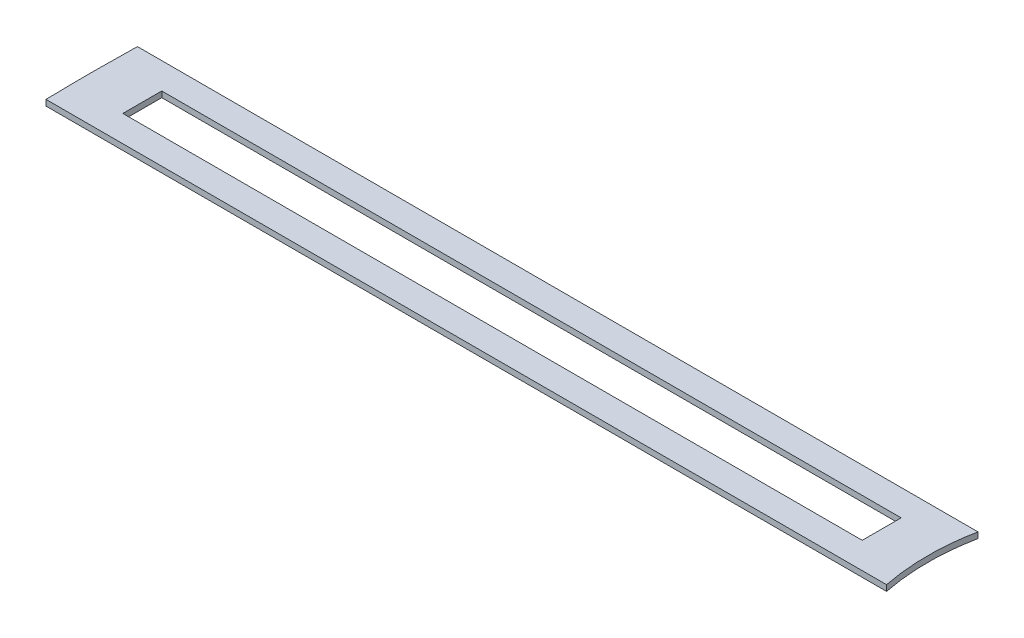
from build123d import *

# Parameters (mm, degrees)
SKETCH1_W           = 380
SKETCH1_H           = 20
BOSS_EXTRUDE1_DEPTH = 1.5


with BuildPart() as part:
    # Sketch1 → Boss-Extrude1 (new, symmetric)
    with BuildSketch(Plane(origin=(0, 0, 0), x_dir=(1, 0, 0), z_dir=(0, 1, 0))):
        with BuildLine():
            Line((216, -23.5), (-216, -23.5))
            add(Edge.make_bspline(
                [(-216, 23.5), (-216.558662782, 0), (-216, -23.5)],
                knots=[4.678781703, 4.678781703, 4.678781703, 4.745996258, 4.745996258, 4.745996258], degree=2, weights=[1, 0.999435329, 1]))
            Line((-216, 23.5), (216, 23.5))
            add(Edge.make_bspline(
                [(216, 23.5), (211.258139768, 0), (216, -23.5)],
                knots=[4.434415205, 4.434415205, 4.434415205, 4.990362756, 4.990362756, 4.990362756], degree=2, weights=[1, 0.961613424, 1]))
        make_face()
        Rectangle(SKETCH1_W, SKETCH1_H, mode=Mode.SUBTRACT)
    extrude(amount=BOSS_EXTRUDE1_DEPTH, both=True)


solid = part.part
